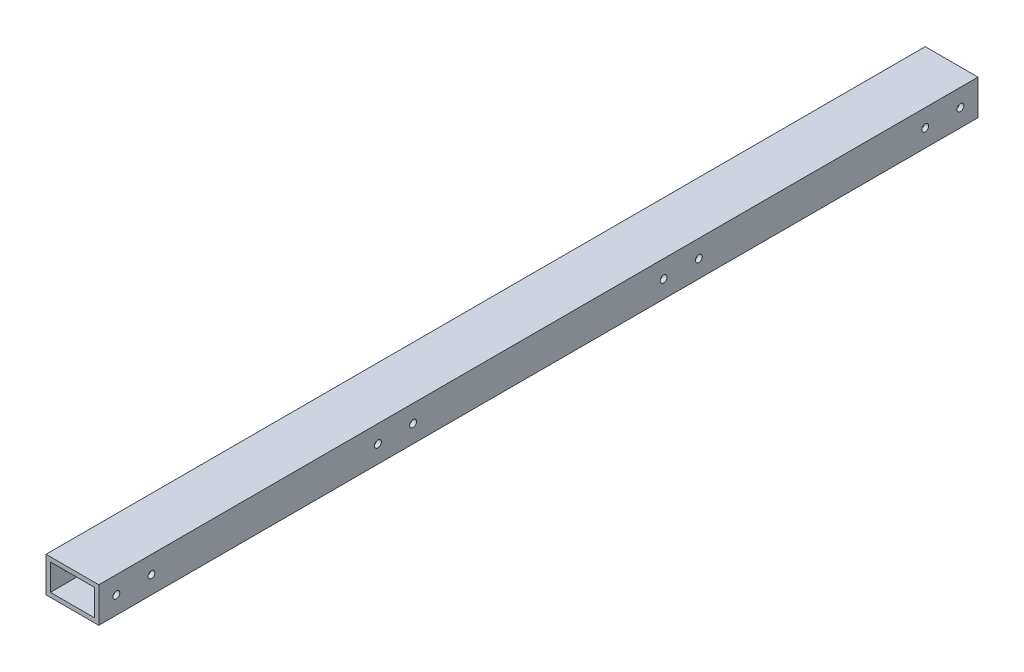
from build123d import *

# Parameters (mm, degrees)
BOSS_EXTRUDE1_DEPTH      = 330.200001
BOSS_EXTRUDE1_DEPTH_BACK = 330.200001
SKETCH3_W                = 38.1
SKETCH3_H                = 25.4
SKETCH3_W_2              = 31.75
SKETCH3_H_2              = 19.05
F_10_CLEARANCE_HOLE1_D   = 4.9784


with BuildPart() as part:
    # Sketch3 → Boss-Extrude1 (new, two sides: drawn at the far end of the back side and taken through both)
    with BuildSketch(Plane.XY.offset(-BOSS_EXTRUDE1_DEPTH_BACK)):
        Rectangle(SKETCH3_W, SKETCH3_H)
        Rectangle(SKETCH3_W_2, SKETCH3_H_2, mode=Mode.SUBTRACT)
    extrude(amount=BOSS_EXTRUDE1_DEPTH + BOSS_EXTRUDE1_DEPTH_BACK)

    # SurfaceCut1
    split(bisect_by=Plane(origin=(0, 0, -304.800000508), x_dir=(-1, 0, 0), z_dir=(0, 0, -1)), keep=Keep.BOTTOM)

    # #10 Clearance Hole1 (through all)
    with Locations(Plane(origin=(19.05, 0, 0), x_dir=(0, 0, -1), z_dir=(1, 0, 0))):
        with Locations((-128.5875, 0), (-103.1875, 0), (77.787500575, 1.014e-06), (103.187500575, 1.014e-06), (-317.500000508, 0), (-292.100000508, 0), (266.700000508, 0), (292.100000508, 0)):
            Hole(F_10_CLEARANCE_HOLE1_D / 2)


solid = part.part
